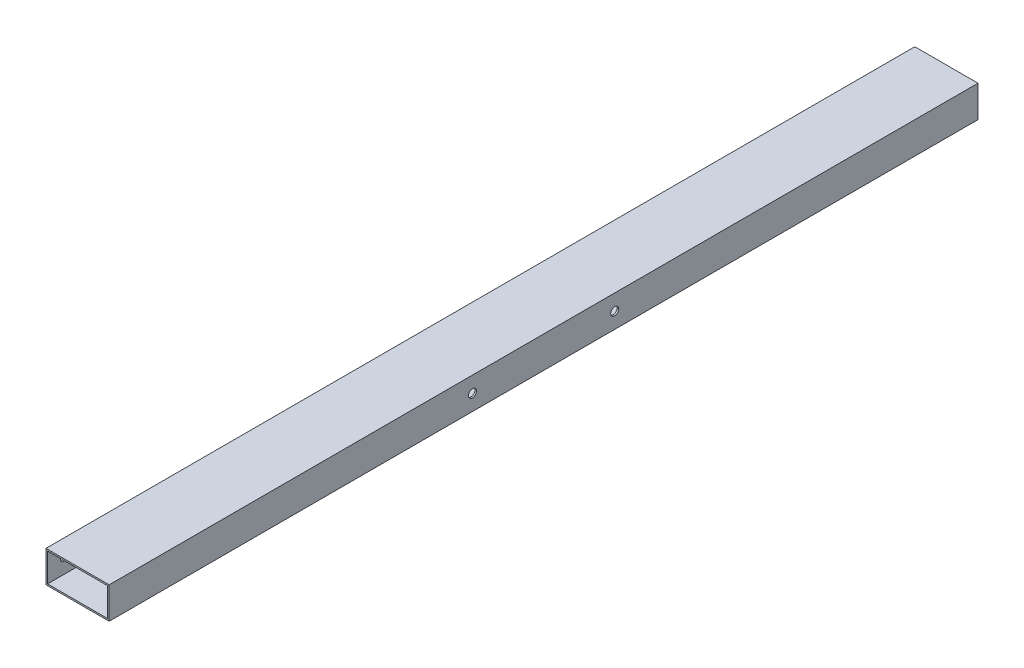
from build123d import *

# Parameters (mm, degrees)
SKETCH_1_W          = 40
SKETCH_1_H          = 20
SKETCH_1_W_2        = 38
SKETCH_1_H_2        = 18
EXTRUDE_1_DEPTH     = 550
SKETCH_4_R          = 1.75
CUT_EXTRUDE_2_DEPTH = 1.5
SKETCH_6_R          = 2.5
CUT_EXTRUDE_3_DEPTH = 552.815186453
SKETCH_7_R          = 1.6
CUT_EXTRUDE_4_DEPTH = 10


with BuildPart() as part:
    # 草图1 → 拉伸-薄壁1 (new body)
    with BuildSketch(Plane.XY):
        with Locations((20, -10)):
            Rectangle(SKETCH_1_W, SKETCH_1_H)
        with Locations((20, -10)):
            Rectangle(SKETCH_1_W_2, SKETCH_1_H_2, mode=Mode.SUBTRACT)
    extrude(amount=EXTRUDE_1_DEPTH)

    # 草图4 → 切除-拉伸2 (cut)
    with BuildSketch(Plane.ZY):
        with Locations((539.996387591, -10)):
            Circle(SKETCH_4_R)
        with Locations((10, -10.000000002)):
            Circle(SKETCH_4_R)
    extrude(amount=-CUT_EXTRUDE_2_DEPTH, mode=Mode.SUBTRACT)

    # 草图6 → 切除-拉伸3 (cut, through all)
    with BuildSketch(Plane(origin=(40, 0, 0), x_dir=(0, 0, -1), z_dir=(1, 0, 0))):
        with Locations((-320, -10)):
            Circle(SKETCH_6_R)
        with Locations((-230, -10)):
            Circle(SKETCH_6_R)
    extrude(amount=-CUT_EXTRUDE_3_DEPTH, mode=Mode.SUBTRACT)

    # 草图7 → 切除-拉伸4 (cut)
    with BuildSketch(Plane.ZY):
        with Locations((190, -10)):
            Circle(SKETCH_7_R)
        with Locations((170, -10)):
            Circle(SKETCH_7_R)
    extrude(amount=-CUT_EXTRUDE_4_DEPTH, mode=Mode.SUBTRACT)


solid = part.part
